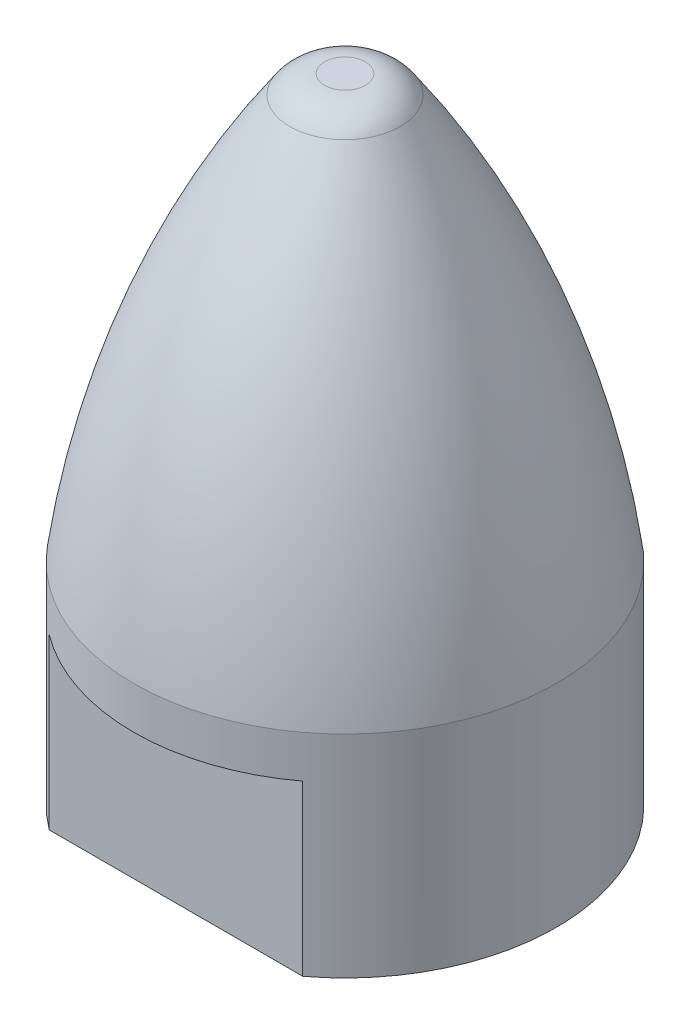
from build123d import *

# Parameters (mm, degrees)
FILLET2_R                 = 1
CUT_EXTRUDE1_DEPTH        = 17.583124103
CUT_EXTRUDE1_DEPTH_BACK   = 17.583124103
SKETCH4_W                 = 3
SKETCH4_H                 = 4
M5X0_8_TAPPED_HOLE1_D     = 4.2
M5X0_8_TAPPED_HOLE1_DEPTH = 8
M5X0_8_TAPPED_HOLE1_TIP   = 1.2618073


with BuildPart() as part:
    # Sketch1 → Revolve2 (revolve)
    with BuildSketch(Plane.XY, mode=Mode.PRIVATE) as revolve2_sk:
        with BuildLine():
            Line((0, 0), (-5, 0))
            Line((-5, 0), (-5, 5))
            ThreePointArc((-5, 5), (-3.621402516, 10.248561006), (-1, 15))
            Line((-1, 15), (0, 15))
            Line((0, 15), (0, 0))
        make_face()
    revolve(revolve2_sk.sketch.rotate(Axis((0, 0, 0), (0, 1, 0)), 270), axis=Axis((0, 0, 0), (0, 1, 0)))

    # Fillet2
    fillet2_edges = [part.edges().sort_by_distance(p)[0] for p in [
        (0, 15, 1),
    ]]
    fillet(fillet2_edges, radius=FILLET2_R)

    # Sketch4 → Cut-Extrude1 (cut, two sides: drawn at the far end of the back side and taken through both)
    with BuildSketch(Plane(origin=(0, 0, 0), x_dir=(0, 0, -1), z_dir=(1, 0, 0)).offset(-CUT_EXTRUDE1_DEPTH_BACK)):
        with Locations((-5.5, 2)):
            Rectangle(SKETCH4_W, SKETCH4_H)
        with Locations((5.5, 2)):
            Rectangle(SKETCH4_W, SKETCH4_H)
    extrude(amount=CUT_EXTRUDE1_DEPTH + CUT_EXTRUDE1_DEPTH_BACK, mode=Mode.SUBTRACT)

    # M5x0.8 Tapped Hole1
    with Locations(Plane(origin=(0, 0, 0), x_dir=(-1, 0, 0), z_dir=(0, -1, 0))):
        with Locations((0, 0)):
            Hole(M5X0_8_TAPPED_HOLE1_D / 2, depth=M5X0_8_TAPPED_HOLE1_DEPTH)
            with Locations((0, 0, -(M5X0_8_TAPPED_HOLE1_DEPTH + M5X0_8_TAPPED_HOLE1_TIP / 2))):  # 118° drill point
                Cone(0, M5X0_8_TAPPED_HOLE1_D / 2, M5X0_8_TAPPED_HOLE1_TIP, mode=Mode.SUBTRACT)


solid = part.part
